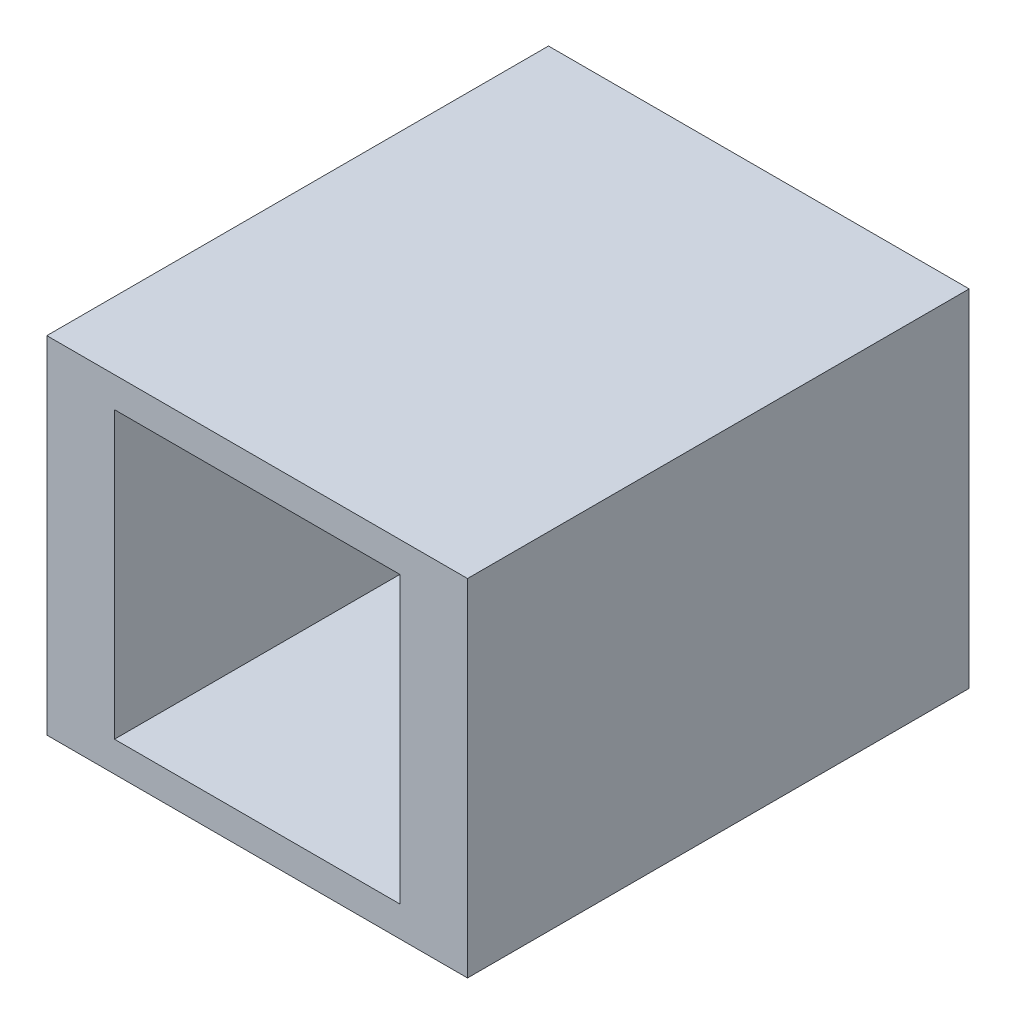
from build123d import *

# Parameters (mm, degrees)
SKETCH_1_W      = 24.32
SKETCH_1_H      = 20
SKETCH_1_W_2    = 16.5
SKETCH_1_H_2    = 16.5
EXTRUDE_1_DEPTH = 29
SKETCH_2_W      = 16.5
SKETCH_2_H      = 16.5
EXTRUDE_2_DEPTH = 1


with BuildPart() as part:
    # 草圖1 → 填料-伸長1 (new body)
    with BuildSketch(Plane.XY):
        Rectangle(SKETCH_1_W, SKETCH_1_H)
        Rectangle(SKETCH_1_W_2, SKETCH_1_H_2, mode=Mode.SUBTRACT)
    extrude(amount=EXTRUDE_1_DEPTH)

    # 草圖2 → 填料-伸長2 (add)
    with BuildSketch(Plane.XY):
        Rectangle(SKETCH_2_W, SKETCH_2_H)
    extrude(amount=EXTRUDE_2_DEPTH)


solid = part.part
